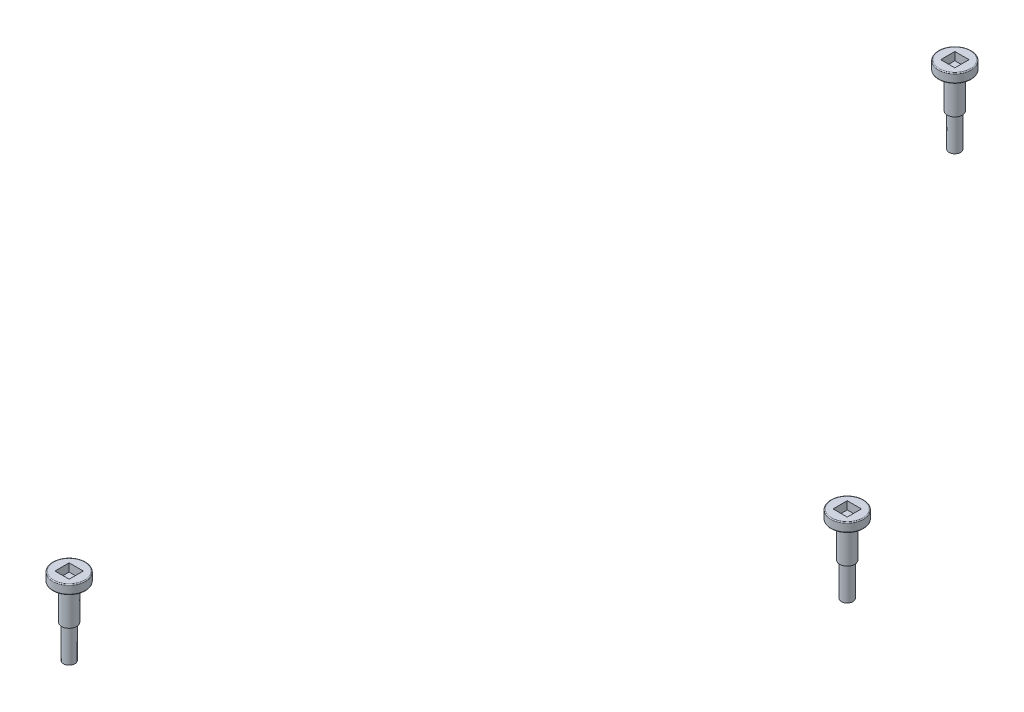
from build123d import *

# Parameters (mm, degrees)
SKETCH1_R             = 4.699
BOSS_EXTRUDE1_DEPTH   = 2.667
BOSS_EXTRUDE1_2_DEPTH = 2.667
BOSS_EXTRUDE1_3_DEPTH = 2.667
SKETCH2_R             = 2.159
BOSS_EXTRUDE2_DEPTH   = 12.7
SKETCH3_R             = 1.651
BOSS_EXTRUDE3_DEPTH   = 22.225
SKETCH4_W             = 4.064
SKETCH4_H             = 4.064
CUT_EXTRUDE1_DEPTH    = 2.286
FILLET1_R             = 0.254
FILLET2_R             = 0.254
FILLET3_R             = 0.254


with BuildPart() as part:
    # Sketch1 → Boss-Extrude1 (new body)
    with BuildSketch(Plane(origin=(0, 0, 0), x_dir=(1, 0, 0), z_dir=(0, 1, 0))):
        with Locations(Location((0, 0, 0), (0, 0, 270))):
            Circle(SKETCH1_R)
    extrude(amount=-BOSS_EXTRUDE1_DEPTH)



with BuildPart() as body_2:
    # Sketch1 → Boss-Extrude1 2 (new body)
    with BuildSketch(Plane(origin=(0, 0, 0), x_dir=(1, 0, 0), z_dir=(0, 1, 0))):
        with Locations(Location((-96.139, 127, 0), (0, 0, 270))):
            Circle(SKETCH1_R)
    extrude(amount=-BOSS_EXTRUDE1_2_DEPTH)


with BuildPart() as body_3:
    # Sketch1 → Boss-Extrude1 3 (new body)
    with BuildSketch(Plane(origin=(0, 0, 0), x_dir=(1, 0, 0), z_dir=(0, 1, 0))):
        with Locations(Location((-96.139, -127, 0), (0, 0, 270))):
            Circle(SKETCH1_R)
    extrude(amount=-BOSS_EXTRUDE1_3_DEPTH)


with BuildPart() as part_1:
    add(part.part)

    add(body_2.part)  # Boss-Extrude2 merges body 2

    add(body_3.part)  # Boss-Extrude2 merges body 3
    # Sketch2 → Boss-Extrude2 (add)
    with BuildSketch(Plane(origin=(0, 0, 0), x_dir=(1, 0, 0), z_dir=(0, 1, 0))):
        with Locations(Location((-96.139, 127, 0), (0, 0, 270))):
            Circle(SKETCH2_R)
        with Locations(Location((0, 0, 0), (0, 0, 270))):
            Circle(SKETCH2_R)
        with Locations(Location((-96.139, -127, 0), (0, 0, 270))):
            Circle(SKETCH2_R)
    extrude(amount=-BOSS_EXTRUDE2_DEPTH)

    # Sketch3 → Boss-Extrude3 (add)
    with BuildSketch(Plane(origin=(0, 0, 0), x_dir=(1, 0, 0), z_dir=(0, 1, 0))):
        with Locations(Location((-96.139, 127, 0), (0, 0, 270))):
            Circle(SKETCH3_R)
        with Locations(Location((0, 0, 0), (0, 0, 270))):
            Circle(SKETCH3_R)
        with Locations(Location((-96.139, -127, 0), (0, 0, 270))):
            Circle(SKETCH3_R)
    extrude(amount=-BOSS_EXTRUDE3_DEPTH)

    # Sketch4 → Cut-Extrude1 (cut)
    with BuildSketch(Plane(origin=(0, 0, 0), x_dir=(1, 0, 0), z_dir=(0, 1, 0))):
        with Locations((-96.139, 127)):
            Rectangle(SKETCH4_W, SKETCH4_H)
        Rectangle(SKETCH4_W, SKETCH4_H)
        with Locations((-96.139, -127)):
            Rectangle(SKETCH4_W, SKETCH4_H)
    extrude(amount=-CUT_EXTRUDE1_DEPTH, mode=Mode.SUBTRACT)

    # Fillet1
    fillet1_edges = [part_1.edges().sort_by_distance(p)[0] for p in [
        (-96.139, 0, 122.301),
        (-96.139, -2.667, 122.301),
    ]]
    fillet(fillet1_edges, radius=FILLET1_R)

    # Fillet2
    fillet2_edges = [part_1.edges().sort_by_distance(p)[0] for p in [
        (0, 0, -4.699),
        (0, -2.667, -4.699),
    ]]
    fillet(fillet2_edges, radius=FILLET2_R)

    # Fillet3
    fillet3_edges = [part_1.edges().sort_by_distance(p)[0] for p in [
        (-96.139, 0, -131.699),
        (-96.139, -2.667, -131.699),
    ]]
    fillet(fillet3_edges, radius=FILLET3_R)


solid = part_1.part
